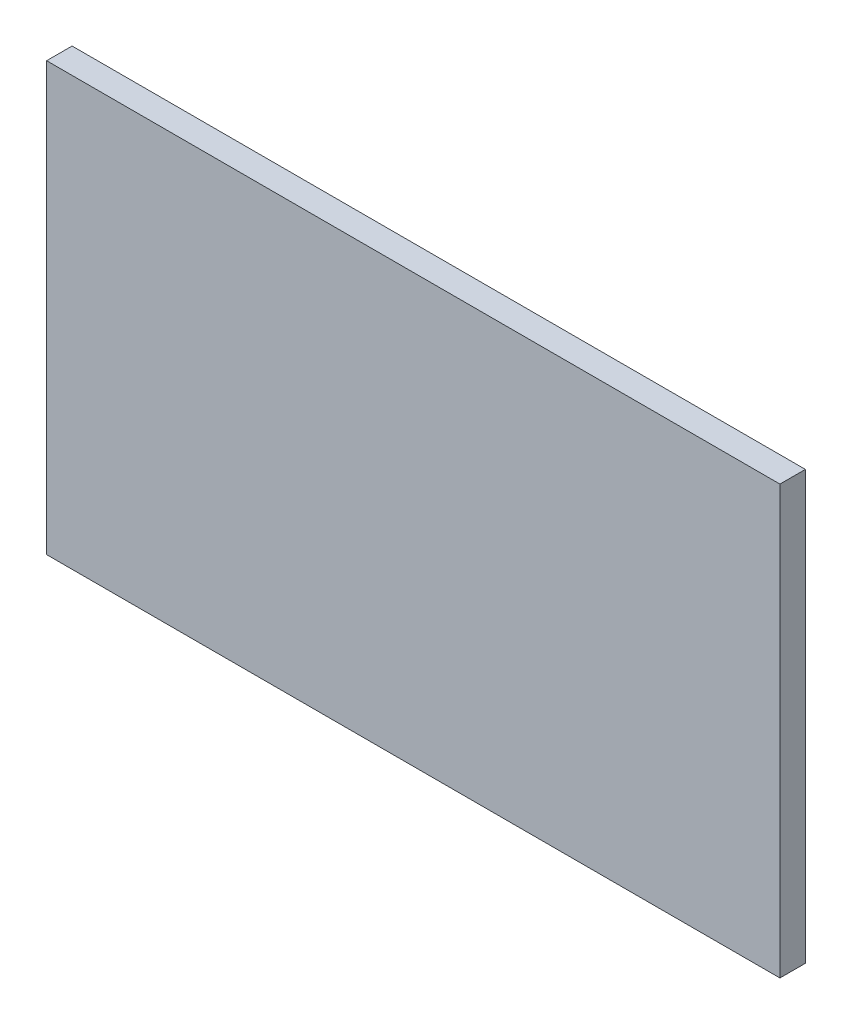
from build123d import *

# Parameters (mm, degrees)
SKETCH1_W           = 1440
SKETCH1_H           = 840
BOSS_EXTRUDE1_DEPTH = 50


with BuildPart() as part:
    # Sketch1 → Boss-Extrude1 (new body)
    with BuildSketch(Plane.XY):
        with Locations((720, 420)):
            Rectangle(SKETCH1_W, SKETCH1_H)
    extrude(amount=BOSS_EXTRUDE1_DEPTH)


solid = part.part
